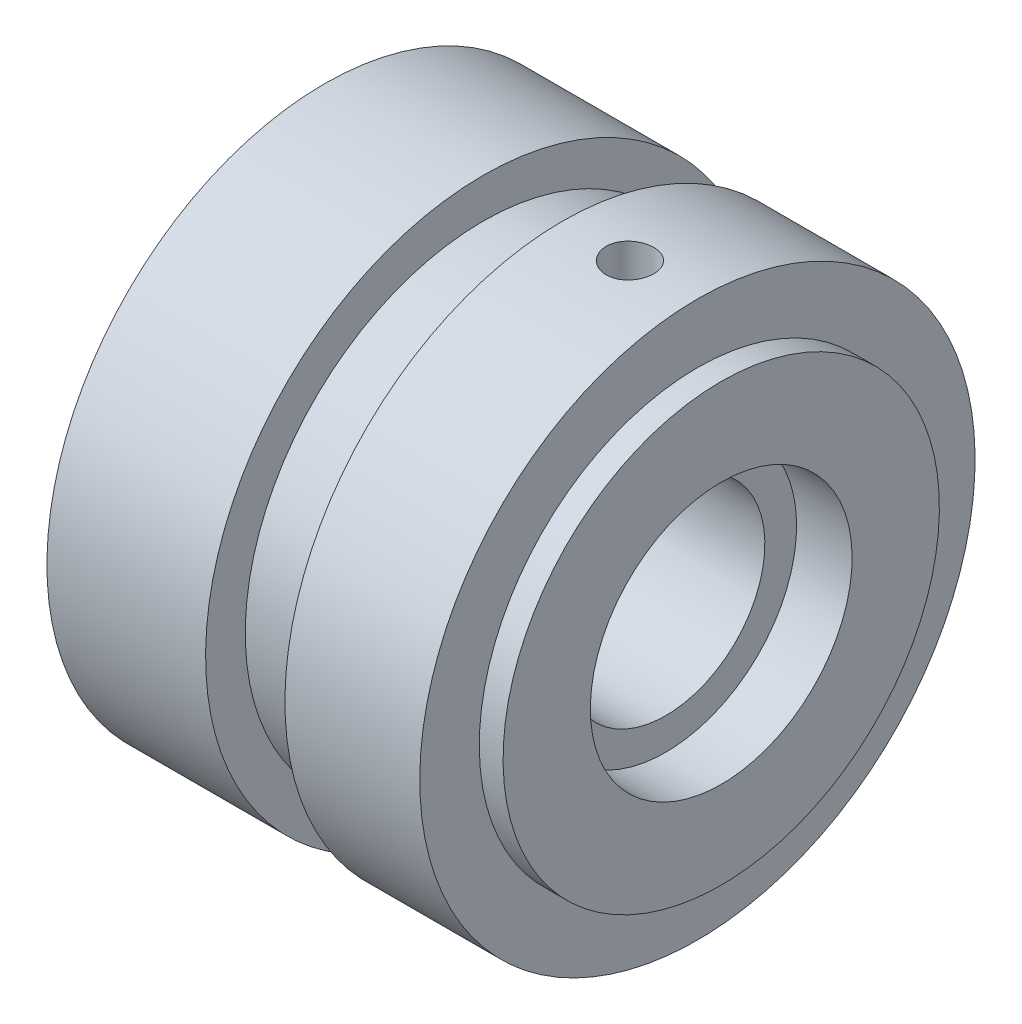
from build123d import *

# Parameters (mm, degrees)
SKETCH2_R          = 16.5
SKETCH2_R_2        = 12.5
CUT_EXTRUDE1_DEPTH = 7
SKETCH3_R          = 35
SKETCH3_R_2        = 27.5
CUT_EXTRUDE2_DEPTH = 3
SKETCH4_R          = 3
CUT_EXTRUDE4_DEPTH = 25


with BuildPart() as part:
    # Sketch1 → Revolve1 (revolve)
    with BuildSketch(Plane.XY):
        Polygon((0, 30), (0, 12.5), (25, 12.5), (25, 35), (5, 35), (5, 30), align=None)
    revolve(axis=Axis((25, 0, 0), (-1, 0, 0)))

    # Mirror1: part across plane


with BuildPart() as part_1:
    add(part.part)
    add(part.part.mirror(Plane(origin=(0, 0, 0), x_dir=(0, 0, 1), z_dir=(1, 0, 0))))

    # Sketch2 → Cut-Extrude1 (cut)
    with BuildSketch(Plane(origin=(25, 0, 0), x_dir=(0, 0, -1), z_dir=(1, 0, 0))):
        with Locations(Location((0, 0, 0), (0, 0, 90))):
            Circle(SKETCH2_R)
        with Locations(Location((0, 0, 0), (0, 0, 90))):
            Circle(SKETCH2_R_2, mode=Mode.SUBTRACT)
    extrude(amount=-CUT_EXTRUDE1_DEPTH, mode=Mode.SUBTRACT)

    # Sketch3 → Cut-Extrude2 (cut)
    with BuildSketch(Plane(origin=(25, 0, 0), x_dir=(0, 0, -1), z_dir=(1, 0, 0))):
        with Locations(Location((0, 0, 0), (0, 0, 90))):
            Circle(SKETCH3_R)
        with Locations(Location((0, 0, 0), (0, 0, 90))):
            Circle(SKETCH3_R_2, mode=Mode.SUBTRACT)
    extrude(amount=-CUT_EXTRUDE2_DEPTH, mode=Mode.SUBTRACT)

    # Sketch4 → Cut-Extrude4 (cut)
    with BuildSketch(Plane(origin=(0, 35, 0), x_dir=(1, 0, 0), z_dir=(0, 1, 0))):
        with Locations((13.5, 0)):
            Circle(SKETCH4_R)
    extrude(amount=-CUT_EXTRUDE4_DEPTH, mode=Mode.SUBTRACT)


solid = part_1.part
